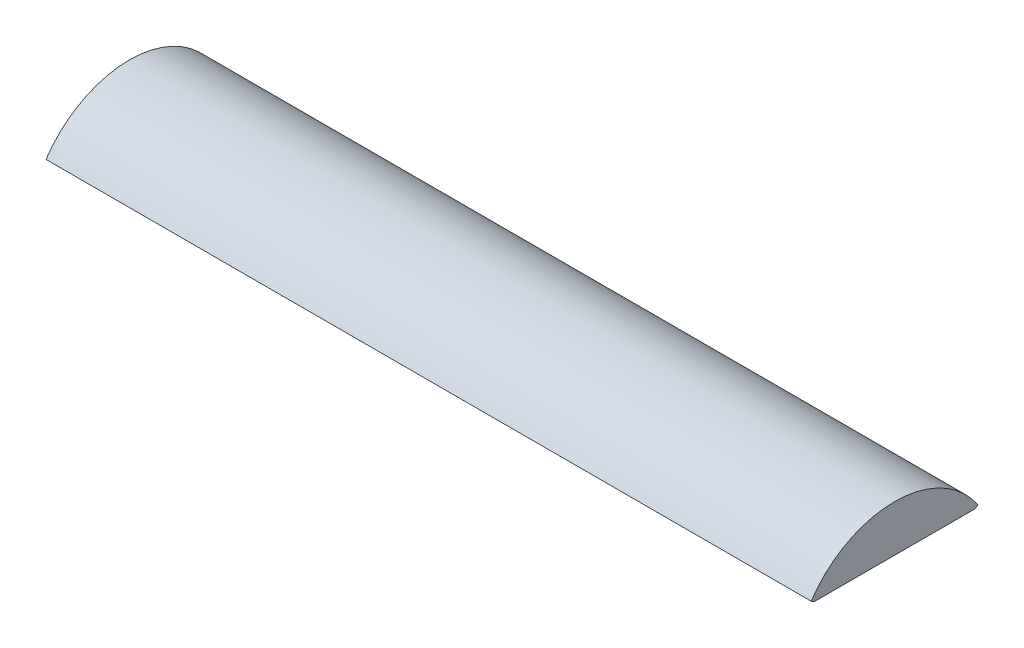
from build123d import *

# Parameters (mm, degrees)
EXTRUIR_L_MINA1_DEPTH   = 332.5
SALIENTE_EXTRUIR1_DEPTH = 0.5
SALIENTE_EXTRUIR2_START = -0.5
SALIENTE_EXTRUIR2_DEPTH = 0.5


with BuildPart() as part:
    # Croquis2 → Extruir-Lámina1 (new body)
    with BuildSketch(Plane(origin=(0, 0, 0), x_dir=(0, 0, -1), z_dir=(1, 0, 0))):
        with BuildLine():
            ThreePointArc((-64.178417971, 0), (-27.928417971, 19.344325839), (8.321582029, 0))
            Line((8.321582029, 0), (7.075512909, -0.835051942))
            ThreePointArc((7.075512909, -0.835051942), (-27.928417971, 17.844325839), (-62.93234885, -0.835051942))
            Line((-62.93234885, -0.835051942), (-64.178417971, 0))
        make_face()
    extrude(amount=EXTRUIR_L_MINA1_DEPTH)

    # Croquis3 → Saliente-Extruir1 (add)
    with BuildSketch(Plane.ZY):
        with BuildLine():
            Line((-7.075512909, -0.835051942), (62.93234885, -0.835051942))
            ThreePointArc((62.93234885, -0.835051942), (27.928417971, 17.844325839), (-7.075512909, -0.835051942))
        make_face()
    extrude(amount=-SALIENTE_EXTRUIR1_DEPTH)

    # Croquis4 → Saliente-Extruir2 (add)
    with BuildSketch(Plane(origin=(332.5, 0, 0), x_dir=(0, 0, -1), z_dir=(1, 0, 0)).offset(SALIENTE_EXTRUIR2_START)):
        with BuildLine():
            Line((-62.93234885, -0.835051942), (7.075512909, -0.835051942))
            ThreePointArc((7.075512909, -0.835051942), (-27.928417971, 17.844325839), (-62.93234885, -0.835051942))
        make_face()
    extrude(amount=SALIENTE_EXTRUIR2_DEPTH)


solid = part.part
